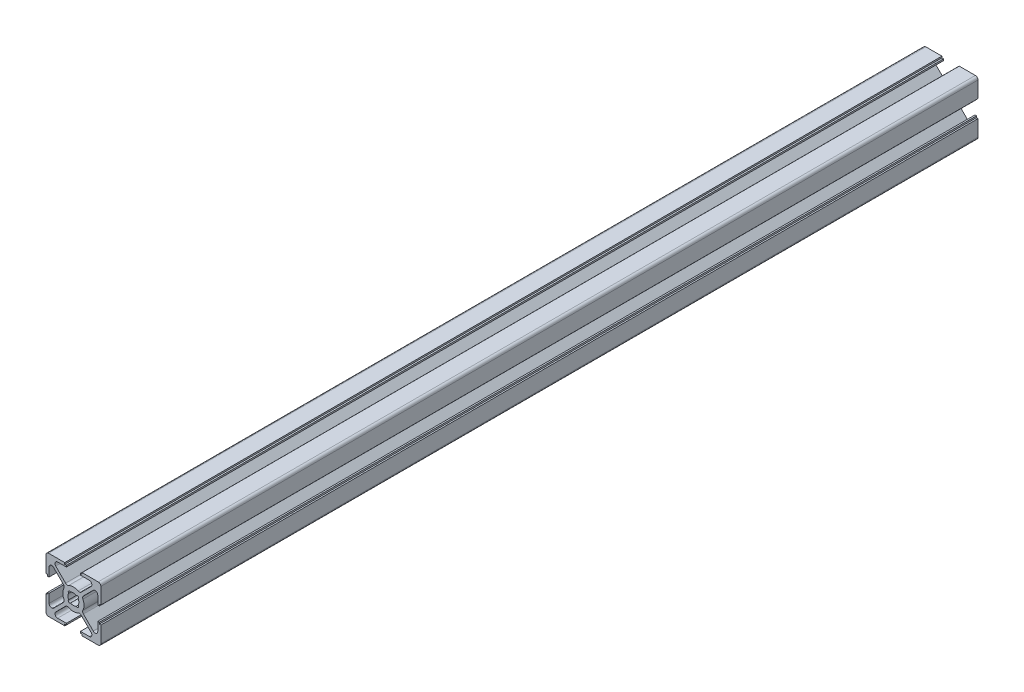
from build123d import *

# Parameters (mm, degrees)
Y_KSEKLIK_EKSTR_ZYON1_DEPTH = 400


with BuildPart() as part:
    # Çizim1 → Yükseklik-Ekstrüzyon1 (new body)
    with BuildSketch(Plane.XY):
        with BuildLine():
            Line((3.95, 12.5), (11.3, 12.5))
            ThreePointArc((11.3, 12.5), (12.148528137, 12.148528137), (12.5, 11.3))
            Line((12.5, 11.3), (12.5, 3.95))
            Line((12.5, 3.95), (11.8, 3.95))
            Line((11.8, 3.95), (11.8, 3.2))
            Line((11.8, 3.2), (11.1, 3.2))
            Line((11.1, 3.2), (11.1, 7.212994231))
            ThreePointArc((11.1, 7.212994231), (10.359220119, 8.321649671), (9.051471863, 8.061522369))
            Line((9.051471863, 8.061522369), (4.55653233, 3.566582836))
            ThreePointArc((4.55653233, 3.566582836), (4.220335715, 2.90891397), (4.332982358, 2.178936411))
            ThreePointArc((4.332982358, 2.178936411), (4.85, 0), (4.332982358, -2.178936411))
            ThreePointArc((4.332982358, -2.178936411), (4.220335715, -2.90891397), (4.55653233, -3.566582836))
            Line((4.55653233, -3.566582836), (9.051471863, -8.061522369))
            ThreePointArc((9.051471863, -8.061522369), (10.359220119, -8.321649671), (11.1, -7.212994231))
            Line((11.1, -7.212994231), (11.1, -3.2))
            Line((11.1, -3.2), (11.8, -3.2))
            Line((11.8, -3.2), (11.8, -3.95))
            Line((11.8, -3.95), (12.5, -3.95))
            Line((12.5, -3.95), (12.5, -11.3))
            ThreePointArc((12.5, -11.3), (12.148528137, -12.148528137), (11.3, -12.5))
            Line((11.3, -12.5), (3.95, -12.5))
            Line((3.95, -12.5), (3.95, -11.8))
            Line((3.95, -11.8), (3.2, -11.8))
            Line((3.2, -11.8), (3.2, -11.1))
            Line((3.2, -11.1), (7.212994231, -11.1))
            ThreePointArc((7.212994231, -11.1), (8.321649671, -10.359220119), (8.061522369, -9.051471863))
            Line((8.061522369, -9.051471863), (3.566582836, -4.55653233))
            ThreePointArc((3.566582836, -4.55653233), (2.90891397, -4.220335715), (2.178936411, -4.332982358))
            ThreePointArc((2.178936411, -4.332982358), (0, -4.85), (-2.178936411, -4.332982358))
            ThreePointArc((-2.178936411, -4.332982358), (-2.90891397, -4.220335715), (-3.566582836, -4.55653233))
            Line((-3.566582836, -4.55653233), (-8.061522369, -9.051471863))
            ThreePointArc((-8.061522369, -9.051471863), (-8.321649671, -10.359220119), (-7.212994231, -11.1))
            Line((-7.212994231, -11.1), (-3.2, -11.1))
            Line((-3.2, -11.1), (-3.2, -11.8))
            Line((-3.2, -11.8), (-3.95, -11.8))
            Line((-3.95, -11.8), (-3.95, -12.5))
            Line((-3.95, -12.5), (-11.3, -12.5))
            ThreePointArc((-11.3, -12.5), (-12.148528137, -12.148528137), (-12.5, -11.3))
            Line((-12.5, -11.3), (-12.5, -3.95))
            Line((-12.5, -3.95), (-11.8, -3.95))
            Line((-11.8, -3.95), (-11.8, -3.2))
            Line((-11.8, -3.2), (-11.1, -3.2))
            Line((-11.1, -3.2), (-11.1, -7.212994231))
            ThreePointArc((-11.1, -7.212994231), (-10.359220119, -8.321649671), (-9.051471863, -8.061522369))
            Line((-9.051471863, -8.061522369), (-4.55653233, -3.566582836))
            ThreePointArc((-4.55653233, -3.566582836), (-4.220335715, -2.90891397), (-4.332982358, -2.178936411))
            ThreePointArc((-4.332982358, -2.178936411), (-4.85, 0), (-4.332982358, 2.178936411))
            ThreePointArc((-4.332982358, 2.178936411), (-4.220335715, 2.90891397), (-4.55653233, 3.566582836))
            Line((-4.55653233, 3.566582836), (-9.051471863, 8.061522369))
            ThreePointArc((-9.051471863, 8.061522369), (-10.359220119, 8.321649671), (-11.1, 7.212994231))
            Line((-11.1, 7.212994231), (-11.1, 3.2))
            Line((-11.1, 3.2), (-11.8, 3.2))
            Line((-11.8, 3.2), (-11.8, 3.95))
            Line((-11.8, 3.95), (-12.5, 3.95))
            Line((-12.5, 3.95), (-12.5, 11.3))
            ThreePointArc((-12.5, 11.3), (-12.148528137, 12.148528137), (-11.3, 12.5))
            Line((-11.3, 12.5), (-3.95, 12.5))
            Line((-3.95, 12.5), (-3.95, 11.8))
            Line((-3.95, 11.8), (-3.2, 11.8))
            Line((-3.2, 11.8), (-3.2, 11.1))
            Line((-3.2, 11.1), (-7.212994231, 11.1))
            ThreePointArc((-7.212994231, 11.1), (-8.321649671, 10.359220119), (-8.061522369, 9.051471863))
            Line((-8.061522369, 9.051471863), (-3.566582836, 4.55653233))
            ThreePointArc((-3.566582836, 4.55653233), (-2.90891397, 4.220335715), (-2.178936411, 4.332982358))
            ThreePointArc((-2.178936411, 4.332982358), (0, 4.85), (2.178936411, 4.332982358))
            ThreePointArc((2.178936411, 4.332982358), (2.90891397, 4.220335715), (3.566582836, 4.55653233))
            Line((3.566582836, 4.55653233), (8.061522369, 9.051471863))
            ThreePointArc((8.061522369, 9.051471863), (8.321649671, 10.359220119), (7.212994231, 11.1))
            Line((7.212994231, 11.1), (3.2, 11.1))
            Line((3.2, 11.1), (3.2, 11.8))
            Line((3.2, 11.8), (3.95, 11.8))
            Line((3.95, 11.8), (3.95, 12.5))
        make_face()
        with BuildLine():
            ThreePointArc((1.295656974, 2.138053555), (0, 2.5), (-1.295656974, 2.138053555))
            ThreePointArc((-1.295656974, 2.138053555), (-2.192031022, 2.192031022), (-2.138053555, 1.295656974))
            ThreePointArc((-2.138053555, 1.295656974), (-2.5, 0), (-2.138053555, -1.295656974))
            ThreePointArc((-2.138053555, -1.295656974), (-2.192031022, -2.192031022), (-1.295656974, -2.138053555))
            ThreePointArc((-1.295656974, -2.138053555), (0, -2.5), (1.295656974, -2.138053555))
            ThreePointArc((1.295656974, -2.138053555), (2.192031022, -2.192031022), (2.138053555, -1.295656974))
            ThreePointArc((2.138053555, -1.295656974), (2.5, 0), (2.138053555, 1.295656974))
            ThreePointArc((2.138053555, 1.295656974), (2.192031022, 2.192031022), (1.295656974, 2.138053555))
        make_face(mode=Mode.SUBTRACT)
    extrude(amount=Y_KSEKLIK_EKSTR_ZYON1_DEPTH)


solid = part.part
